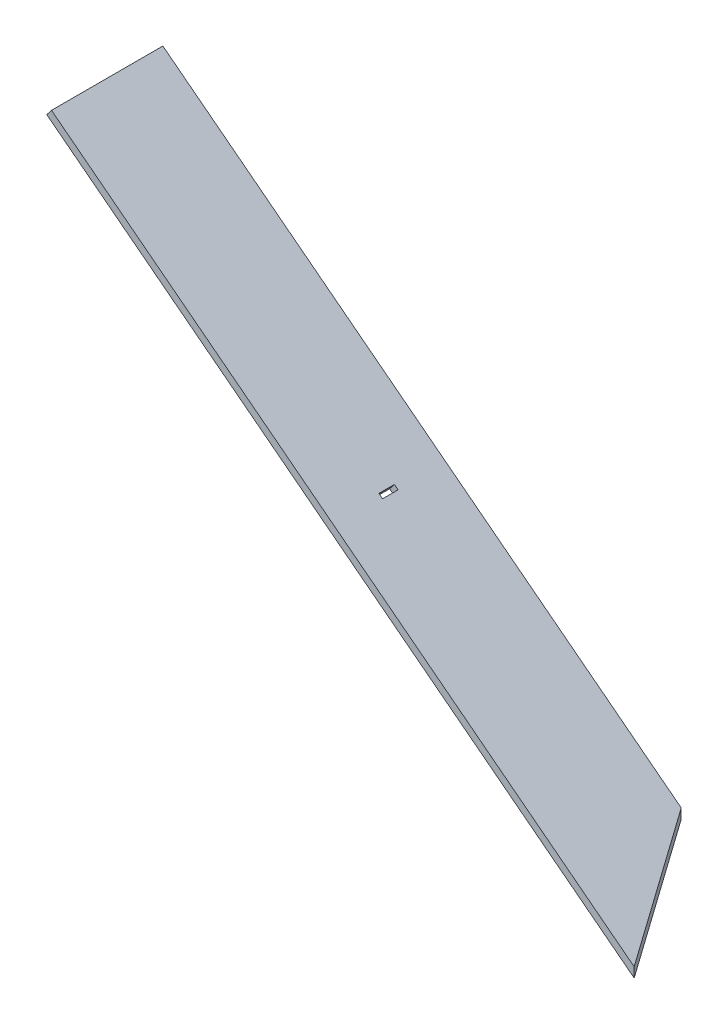
from build123d import *

# Parameters (mm, degrees)
BOSS_EXTRUDE1_DEPTH     = 240.2
CUT_EXTRUDE3_DEPTH      = 540.188032545
CUT_EXTRUDE3_DEPTH_BACK = 540.188032545
SKETCH2_OUTSIDE_W       = 932.224
SKETCH2_OUTSIDE_H       = 412.374
SKETCH2_OUTSIDE_W_2     = 760.049325768
SKETCH2_OUTSIDE_H_2     = 72.06
CUT_EXTRUDE4_DEPTH      = 540.188032545
CUT_EXTRUDE5_DEPTH      = 540.182188788
CUT_EXTRUDE5_DEPTH_BACK = 540.182188788
SKETCH4_W               = 3
SKETCH4_H               = 10


with BuildPart() as part:
    # Sketch1 → Boss-Extrude1 (new body)
    with BuildSketch(Plane.XY):
        Polygon((0, 0), (380.024662884, 293.716437401), (376.967027683, 297.672555066), (0, 6.319326703), (-376.967027683, 297.672555066), (-380.024662884, 293.716437401), align=None)
    extrude(amount=-BOSS_EXTRUDE1_DEPTH)

    # Sketch2 outside → Cut-Extrude3 (cut, two sides: drawn at the far end of the back side and taken through both)
    with BuildSketch(Plane(origin=(0, 0, 0), x_dir=(1, 0, 0), z_dir=(0, 1, 0)).offset(-CUT_EXTRUDE3_DEPTH_BACK)):
        with Locations((0, 120.1)):
            Rectangle(SKETCH2_OUTSIDE_W, SKETCH2_OUTSIDE_H)
        with Locations((0, 204.17)):
            Rectangle(SKETCH2_OUTSIDE_W_2, SKETCH2_OUTSIDE_H_2, mode=Mode.SUBTRACT)
    extrude(amount=CUT_EXTRUDE3_DEPTH + CUT_EXTRUDE3_DEPTH_BACK, mode=Mode.SUBTRACT)

    # Sketch3 → Cut-Extrude4 (cut, through all)
    with BuildSketch(Plane(origin=(0, 0, 0), x_dir=(1, 0, 0), z_dir=(0, 1, 0))):
        Polygon((41.603860398, 240.2), (0, 168.14), (380.024662884, 168.14), (380.024662884, 240.2), align=None)
        Polygon((41.603860398, 240.2), (-41.603860398, 240.2), (0, 168.14), align=None)
    extrude(amount=CUT_EXTRUDE4_DEPTH, mode=Mode.SUBTRACT)

    # Sketch4 → Cut-Extrude5 (cut, two sides: drawn at the far end of the back side and taken through both)
    with BuildSketch(Plane(origin=(3.057635201, 3.956117665, 0), x_dir=(0.7912235329674936, -0.6115270401858268, 0), z_dir=(0.6115270401858268, 0.7912235329674936, 0)).offset(-CUT_EXTRUDE5_DEPTH_BACK)):
        with Locations((-250.282219577, 204.17)):
            Rectangle(SKETCH4_W, SKETCH4_H)
    extrude(amount=CUT_EXTRUDE5_DEPTH + CUT_EXTRUDE5_DEPTH_BACK, mode=Mode.SUBTRACT)


solid = part.part
